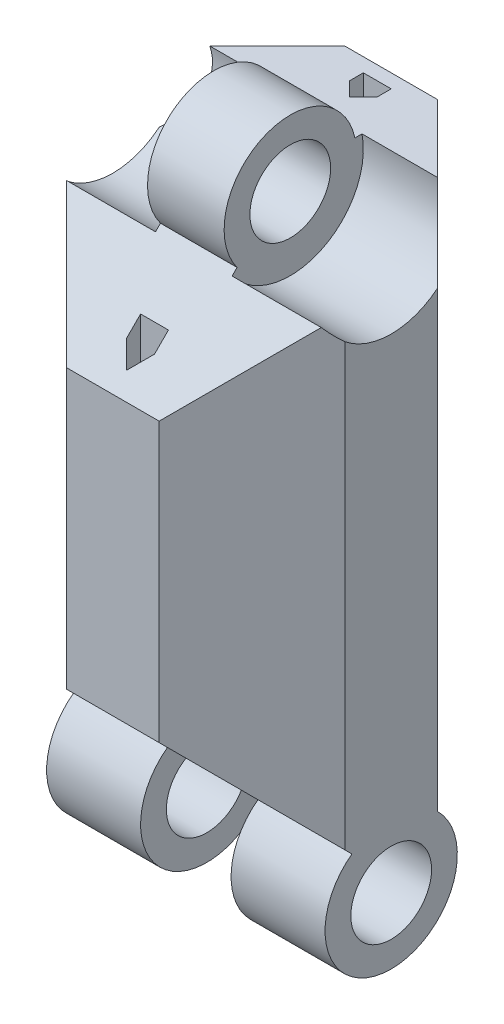
from build123d import *

# Parameters (mm, degrees)
BOSS_EXTRUDE1_DEPTH     = 20
CUT_EXTRUDE1_DEPTH      = 22.213203436
CUT_EXTRUDE1_DEPTH_BACK = 22.213203436
CUT_EXTRUDE2_DEPTH      = 22.213203436
SKETCH4_R               = 2.375
BOSS_EXTRUDE2_DEPTH     = 1.375
SKETCH5_R               = 2.625
CUT_EXTRUDE3_DEPTH      = 24.327156921
SKETCH6_R               = 2.625
CUT_EXTRUDE4_DEPTH      = 1.625
BOSS_EXTRUDE3_REACH     = 25.397
SKETCH7_R               = 2.375
BOSS_EXTRUDE4_START     = -3.375
SKETCH8_R               = 2.375
BOSS_EXTRUDE4_DEPTH     = 3.375
CUT_EXTRUDE5_DEPTH      = 24.327156921
CUT_EXTRUDE5_DEPTH_BACK = 24.327156921
SKETCH10_R              = 1.45
CUT_EXTRUDE6_DEPTH      = 25.566555009
CUT_EXTRUDE6_DEPTH_BACK = 25.566555009
SKETCH11_R              = 1.45


with BuildPart() as part:
    # Sketch1 → Boss-Extrude1 (new body)
    with BuildSketch(Plane(origin=(0, 0, 0), x_dir=(1, 0, 0), z_dir=(0, 1, 0))):
        Polygon((-1.666666667, -5), (1.666666667, -5), (5, -1.666666667), (5, 1.666666667), (1.666666667, 5), (-1.666666667, 5), (-5, 1.666666667), (-5, -1.666666667), align=None)
    extrude(amount=BOSS_EXTRUDE1_DEPTH)

    # Sketch2 → Cut-Extrude1 (cut, two sides: drawn at the far end of the back side and taken through both)
    with BuildSketch(Plane(origin=(0, 0, 0), x_dir=(0, 0, -1), z_dir=(1, 0, 0)).offset(-CUT_EXTRUDE1_DEPTH_BACK)):
        Polygon((0, 20), (-5, 20), (-5, 15), align=None)
        Polygon((0, 0), (-5, 0), (-5, 5), align=None)
    extrude(amount=CUT_EXTRUDE1_DEPTH + CUT_EXTRUDE1_DEPTH_BACK, mode=Mode.SUBTRACT)

    # Sketch3 → Cut-Extrude2 (cut, through all)
    with BuildSketch(Plane(origin=(0, 0, 0), x_dir=(1, 0, 0), z_dir=(0, 1, 0))):
        Polygon((0, -4.5), (-0.5, -4), (-0.5, -3.5), (0.5, -3.5), (0.5, -4), align=None)
        Polygon((0.5, 4.5), (0.5, 4), (0, 3.5), (-0.5, 4), (-0.5, 4.5), align=None)
    extrude(amount=CUT_EXTRUDE2_DEPTH, mode=Mode.SUBTRACT)

    # Sketch4 → Boss-Extrude2 (add, symmetric)
    with BuildSketch(Plane(origin=(0, 0, 0), x_dir=(0, 0, -1), z_dir=(1, 0, 0))):
        with Locations((0, 19.5)):
            Circle(SKETCH4_R)
    extrude(amount=BOSS_EXTRUDE2_DEPTH, both=True)

    # Sketch5 → Cut-Extrude3 (cut, through all)
    with BuildSketch(Plane(origin=(1.375, 0, 0), x_dir=(0, 0, -1), z_dir=(1, 0, 0))):
        with Locations((0, 19.5)):
            Circle(SKETCH5_R)
    cut_extrude3 = extrude(amount=CUT_EXTRUDE3_DEPTH, mode=Mode.SUBTRACT)

    # Mirror1: Cut-Extrude3 across plane
    add(cut_extrude3.mirror(Plane(origin=(0, 0, 0), x_dir=(0, 0, 1), z_dir=(1, 0, 0))), mode=Mode.SUBTRACT)

    # Sketch6 → Cut-Extrude4 (cut, symmetric)
    with BuildSketch(Plane(origin=(0, 0, 0), x_dir=(0, 0, -1), z_dir=(1, 0, 0))):
        with Locations((0, -0.5)):
            Circle(SKETCH6_R)
    extrude(amount=CUT_EXTRUDE4_DEPTH, both=True, mode=Mode.SUBTRACT)

    # Boss-Extrude3: up to this face of the body (flat: up to its plane)
    boss_extrude3_end = Plane(part.part.faces().sort_by_distance((-5, 8.732537251, -0.027810101))[0])
    # Sketch7 → Boss-Extrude3 (add, up to the picked face)
    with BuildSketch(Plane(origin=(-1.625, 0, 0), x_dir=(0, 0, -1), z_dir=(1, 0, 0)), mode=Mode.PRIVATE) as boss_extrude3_sk1:
        with Locations((0, -0.5)):
            Circle(SKETCH7_R)
    boss_extrude3_tool1 = split(extrude(boss_extrude3_sk1.sketch, amount=-BOSS_EXTRUDE3_REACH, mode=Mode.PRIVATE), bisect_by=boss_extrude3_end, keep=Keep.BOTH, mode=Mode.PRIVATE)
    add(boss_extrude3_tool1.solids().sort_by(Axis((-1.625, -0.5, 0), (-1, 0, 0)))[0])

    # Sketch8 → Boss-Extrude4 (add)
    with BuildSketch(Plane.ZY.offset(-1.625).offset(BOSS_EXTRUDE4_START)):
        with Locations((0, -0.5)):
            Circle(SKETCH8_R)
    extrude(amount=BOSS_EXTRUDE4_DEPTH)

    # Sketch10 → Cut-Extrude5 (cut, two sides: drawn at the far end of the back side and taken through both)
    with BuildSketch(Plane(origin=(1.375, 0, 0), x_dir=(0, 0, -1), z_dir=(1, 0, 0)).offset(-CUT_EXTRUDE5_DEPTH_BACK)):
        with Locations((0, 19.5)):
            Circle(SKETCH10_R)
    extrude(amount=CUT_EXTRUDE5_DEPTH + CUT_EXTRUDE5_DEPTH_BACK, mode=Mode.SUBTRACT)

    # Sketch11 → Cut-Extrude6 (cut, two sides: drawn at the far end of the back side and taken through both)
    with BuildSketch(Plane(origin=(5, 0, 0), x_dir=(0, 0, -1), z_dir=(1, 0, 0)).offset(-CUT_EXTRUDE6_DEPTH_BACK)):
        with Locations((0, -0.5)):
            Circle(SKETCH11_R)
    extrude(amount=CUT_EXTRUDE6_DEPTH + CUT_EXTRUDE6_DEPTH_BACK, mode=Mode.SUBTRACT)


solid = part.part
